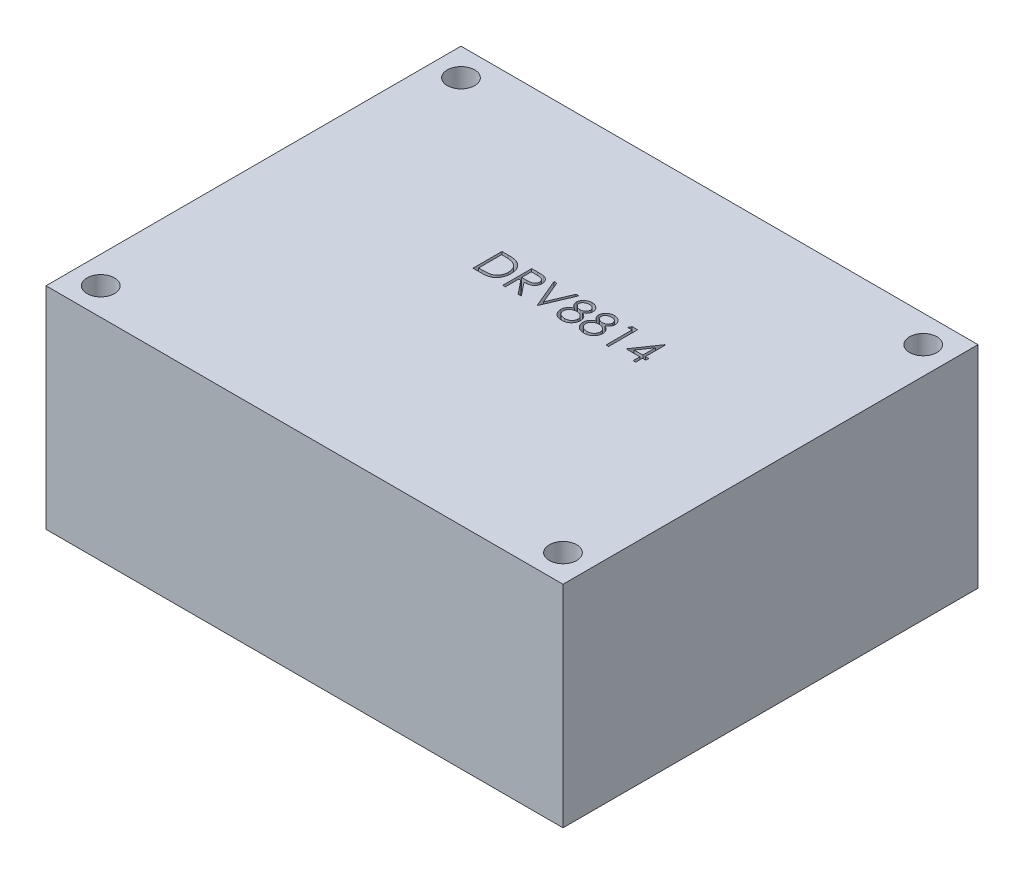
from build123d import *

# Parameters (mm, degrees)
SKETCH1_W           = 56.642
SKETCH1_H           = 45.466
BOSS_EXTRUDE1_DEPTH = 23.114
SKETCH2_R           = 1.5
CUT_EXTRUDE1_DEPTH  = 77.221586942
CUT_EXTRUDE2_DEPTH  = 1.27


with BuildPart() as part:
    # Sketch1 → Boss-Extrude1 (new body)
    with BuildSketch(Plane(origin=(0, 0, 0), x_dir=(1, 0, 0), z_dir=(0, 1, 0))):
        with Locations((28.321, 22.733)):
            Rectangle(SKETCH1_W, SKETCH1_H)
    extrude(amount=BOSS_EXTRUDE1_DEPTH)

    # Sketch2 → Cut-Extrude1 (cut, through all)
    with BuildSketch(Plane(origin=(0, 0, 0), x_dir=(-1, 0, 0), z_dir=(0, -1, 0))):
        with Locations(Location((-3, 42.466, 0), (0, 0, 90))):
            Circle(SKETCH2_R)
        with Locations(Location((-53.642, 42.466, 0), (0, 0, 270))):
            Circle(SKETCH2_R)
        with Locations(Location((-3, 3, 0), (0, 0, 270))):
            Circle(SKETCH2_R)
        with Locations(Location((-53.642, 3, 0), (0, 0, 90))):
            Circle(SKETCH2_R)
    extrude(amount=-CUT_EXTRUDE1_DEPTH, mode=Mode.SUBTRACT)

    # Sketch3 → Cut-Extrude2 (cut)
    # profile 1 of 7: a face of its own
    with BuildSketch(Plane(origin=(0, 23.114, 0), x_dir=(1, 0, 0), z_dir=(0, 1, 0))):
        with BuildLine():
            Line((21.72409313, 25.057589559), (21.72409313, 28.232589559))
            Line((21.72409313, 28.232589559), (22.365198899, 28.232589559))
            add(Edge.make_bspline(
                [(22.365198899, 28.232589559), (22.420960053, 28.232188085), (22.528690311, 28.231412439), (22.684367317, 28.226494463), (22.828406873, 28.21779454), (22.960335252, 28.205122184), (23.080514638, 28.189561932), (23.188608518, 28.170057994), (23.285175819, 28.147027297), (23.344565954, 28.127391781), (23.372650822, 28.118106386)],
                knots=[0, 0, 0, 0, 1.314313732, 2.53924729, 3.670748893, 4.714932338, 5.66265055, 6.526160246, 7.303039223, 8, 8, 8, 8], degree=3))
            add(Edge.make_bspline(
                [(23.372650822, 28.118106386), (23.409385336, 28.104108532), (23.482021346, 28.076430248), (23.585442093, 28.02421846), (23.682801529, 27.965060861), (23.774621753, 27.898879471), (23.85880536, 27.823800383), (23.938641095, 27.743012884), (24.010863023, 27.653579176), (24.077001263, 27.557354008), (24.136632897, 27.455470932), (24.188466276, 27.348124083), (24.231513827, 27.235858616), (24.267249111, 27.118986732), (24.295412683, 26.997251446), (24.314627721, 26.870511011), (24.327301405, 26.739266317), (24.32857508, 26.650208054), (24.329221335, 26.605020449)],
                knots=[0, 0, 0, 0, 0.984719456, 1.947108742, 2.898477687, 3.838006223, 4.779231079, 5.722358779, 6.681677486, 7.655904652, 8.64651281, 9.637519902, 10.640069247, 11.656948941, 12.698408672, 13.768548281, 14.867775369, 16, 16, 16, 16], degree=3))
            add(Edge.make_bspline(
                [(24.329221335, 26.605020449), (24.328650772, 26.565776325), (24.327526417, 26.488441681), (24.317430538, 26.37446744), (24.302756304, 26.263874414), (24.280037639, 26.157189244), (24.252458216, 26.053477217), (24.217112165, 25.953843681), (24.176621393, 25.857374654), (24.129404718, 25.765374516), (24.077569318, 25.678213171), (24.021941737, 25.596048227), (23.962581306, 25.520052133), (23.898921982, 25.449994749), (23.831786411, 25.385981689), (23.760735054, 25.327478218), (23.685584572, 25.275629057), (23.606671559, 25.228396752), (23.521693928, 25.187194001), (23.429042106, 25.152332492), (23.328320966, 25.123443063), (23.219777734, 25.099339464), (23.103224865, 25.08021934), (22.978548089, 25.067404684), (22.845938962, 25.058738809), (22.754880628, 25.057980081), (22.708012401, 25.057589559)],
                knots=[0, 0, 0, 0, 1.105936401, 2.179363191, 3.223086493, 4.248585256, 5.251745608, 6.245858792, 7.225916811, 8.198733463, 9.158002045, 10.082870192, 10.993790845, 11.873723703, 12.748670949, 13.606408763, 14.465103618, 15.319838547, 16.196477973, 17.123216899, 18.106603292, 19.147568657, 20.255746949, 21.433717677, 22.679120308, 24, 24, 24, 24], degree=3))
            Line((22.708012401, 25.057589559), (21.72409313, 25.057589559))
        make_face()
        with BuildLine():
            Line((22.009029027, 25.383230585), (22.373467128, 25.383230585))
            add(Edge.make_bspline(
                [(22.373467128, 25.383230585), (22.425835007, 25.383455644), (22.526557617, 25.383888514), (22.671390229, 25.387686906), (22.803723682, 25.39389352), (22.923576765, 25.402579484), (23.030881809, 25.414071728), (23.125863068, 25.426885032), (23.208209195, 25.442848434), (23.258038041, 25.457318233), (23.281064284, 25.464004824)],
                knots=[0, 0, 0, 0, 1.375205317, 2.645023457, 3.804390687, 4.853969522, 5.800190428, 6.637939096, 7.370582563, 8, 8, 8, 8], degree=3))
            add(Edge.make_bspline(
                [(23.281064284, 25.464004824), (23.310046012, 25.474211594), (23.367317241, 25.494381347), (23.449759368, 25.53117294), (23.52664608, 25.57475396), (23.599317317, 25.623197452), (23.666742212, 25.678212039), (23.729719803, 25.738601436), (23.788123294, 25.804672982), (23.841349273, 25.876344671), (23.888981806, 25.953170415), (23.930230707, 26.034394928), (23.96638174, 26.119128249), (23.994755891, 26.208671557), (24.016995029, 26.302224346), (24.032747281, 26.399793196), (24.042557781, 26.501359888), (24.043702095, 26.570440743), (24.044285438, 26.605656466)],
                knots=[0, 0, 0, 0, 0.998632004, 1.973411704, 2.929992603, 3.868527914, 4.809262121, 5.754881198, 6.702106254, 7.672490631, 8.653608572, 9.636854334, 10.631411391, 11.644891563, 12.686317036, 13.754757253, 14.855430412, 16, 16, 16, 16], degree=3))
            add(Edge.make_bspline(
                [(24.044285438, 26.605656466), (24.043819813, 26.64278898), (24.042905088, 26.715736133), (24.031407678, 26.82277055), (24.014605981, 26.925713711), (23.990309352, 27.024572503), (23.959347769, 27.119539794), (23.920708344, 27.210090349), (23.876560768, 27.297180481), (23.824034169, 27.378800084), (23.766507167, 27.45599169), (23.702664376, 27.526707935), (23.633520098, 27.591109907), (23.559828485, 27.650200569), (23.479512688, 27.701602618), (23.394464697, 27.747582679), (23.303436838, 27.786604237), (23.24010675, 27.807358634), (23.207922256, 27.817906066)],
                knots=[0, 0, 0, 0, 1.122418816, 2.205001699, 3.251619955, 4.274784885, 5.280384055, 6.268708349, 7.249350384, 8.229342522, 9.199999885, 10.157847722, 11.105861043, 12.055065948, 13.010012805, 13.98527497, 14.976112212, 16, 16, 16, 16], degree=3))
            add(Edge.make_bspline(
                [(23.207922256, 27.817906066), (23.181296574, 27.825268825), (23.124683067, 27.840924072), (23.032300124, 27.858001374), (22.92832781, 27.873064027), (22.81230451, 27.885816677), (22.684362479, 27.894967318), (22.544403319, 27.901835582), (22.392366535, 27.906468028), (22.28697238, 27.906784355), (22.232271215, 27.906948533)],
                knots=[0, 0, 0, 0, 0.674548936, 1.434276114, 2.292660221, 3.240891867, 4.284742987, 5.42552168, 6.663806718, 8, 8, 8, 8], degree=3))
            Line((22.232271215, 27.906948533), (22.009029027, 27.906948533))
            Line((22.009029027, 27.906948533), (22.009029027, 25.383230585))
        make_face(mode=Mode.SUBTRACT)
    # profile 2 of 7: a face of its own
    with BuildSketch(Plane(origin=(0, 23.114, 0), x_dir=(1, 0, 0), z_dir=(0, 1, 0))):
        with BuildLine():
            Line((24.980503386, 28.232589559), (25.615884997, 28.232589559))
            add(Edge.make_bspline(
                [(25.615884997, 28.232589559), (25.658285878, 28.23244842), (25.739700266, 28.232177418), (25.85633459, 28.230666334), (25.962313456, 28.226335311), (26.057581453, 28.222608239), (26.142136833, 28.215811978), (26.216238876, 28.209316248), (26.279546287, 28.200812998), (26.317869309, 28.192915936), (26.335220934, 28.18934036)],
                knots=[0, 0, 0, 0, 1.410062039, 2.707475311, 3.878576406, 4.937260626, 5.877586885, 6.699081471, 7.410979367, 8, 8, 8, 8], degree=3))
            add(Edge.make_bspline(
                [(26.335220934, 28.18934036), (26.358449801, 28.18360108), (26.404411998, 28.172244955), (26.470588129, 28.148242317), (26.533647552, 28.120465943), (26.593328321, 28.087841711), (26.649331503, 28.050127447), (26.702234542, 28.007974221), (26.752277498, 27.961612685), (26.797436549, 27.909873936), (26.840016974, 27.855593673), (26.875929514, 27.796898122), (26.906887106, 27.735519451), (26.931534646, 27.670833436), (26.951381094, 27.6034674), (26.965374897, 27.532811135), (26.973767045, 27.459186536), (26.974621443, 27.408969004), (26.975054668, 27.383506025)],
                knots=[0, 0, 0, 0, 1.027469482, 2.033020251, 3.019912614, 3.986113645, 4.951240523, 5.91722682, 6.890402269, 7.87763091, 8.8651537, 9.85103654, 10.82876324, 11.815024772, 12.821070561, 13.842952187, 14.906261191, 16, 16, 16, 16], degree=3))
            add(Edge.make_bspline(
                [(26.975054668, 27.383506025), (26.973722077, 27.341201323), (26.971121847, 27.258653893), (26.94687836, 27.138855807), (26.907166803, 27.0271055), (26.852444962, 26.923543679), (26.782758723, 26.830189022), (26.699006948, 26.748191966), (26.601142915, 26.67957576), (26.510039179, 26.631993573), (26.429562726, 26.601520005), (26.363311078, 26.580078451), (26.291041748, 26.56351224), (26.213447166, 26.548671263), (26.130204422, 26.537466512), (26.041513029, 26.529259958), (25.947309734, 26.524130929), (25.882595007, 26.52336711), (25.849303466, 26.522974175)],
                knots=[0, 0, 0, 0, 1.260483769, 2.459530307, 3.627416485, 4.787058657, 5.939039949, 7.08810263, 8.267026773, 9.491475466, 10.141966685, 10.831826277, 11.566392101, 12.351337768, 13.187381173, 14.07005841, 15.007169909, 16, 16, 16, 16], degree=3))
            Line((25.849303466, 26.522974175), (27.015759797, 25.057589559))
            Line((27.015759797, 25.057589559), (26.663406031, 25.057589559))
            Line((26.663406031, 25.057589559), (25.4969497, 26.522974175))
            Line((25.4969497, 26.522974175), (25.265439284, 26.522974175))
            Line((25.265439284, 26.522974175), (25.265439284, 25.057589559))
            Line((25.265439284, 25.057589559), (24.980503386, 25.057589559))
            Line((24.980503386, 25.057589559), (24.980503386, 28.232589559))
        make_face()
        with BuildLine():
            Line((25.265439284, 27.906948533), (25.265439284, 26.8486152))
            Line((25.265439284, 26.8486152), (25.846759396, 26.844163077))
            add(Edge.make_bspline(
                [(25.846759396, 26.844163077), (25.873901146, 26.844151069), (25.926509587, 26.844127795), (26.002619475, 26.847750721), (26.073485577, 26.851872159), (26.13883683, 26.858176209), (26.198702431, 26.866300645), (26.253052456, 26.876463352), (26.301975624, 26.888303438), (26.359033584, 26.906629198), (26.422748152, 26.935663229), (26.49199169, 26.977904789), (26.550958097, 27.031035347), (26.600776443, 27.091789839), (26.640808142, 27.158588436), (26.66903122, 27.230630428), (26.686940435, 27.306097092), (26.689052759, 27.357965804), (26.690118771, 27.384142043)],
                knots=[0, 0, 0, 0, 1.146690395, 2.22261258, 3.21895312, 4.145990853, 4.996080663, 5.770904154, 6.481378293, 7.121626537, 8.300444488, 9.431385265, 10.535395872, 11.636531494, 12.74115979, 13.810798291, 14.895190096, 16, 16, 16, 16], degree=3))
            add(Edge.make_bspline(
                [(26.690118771, 27.384142043), (26.689028275, 27.409675006), (26.686867311, 27.460272023), (26.6692245, 27.534345599), (26.639389132, 27.604256332), (26.599182531, 27.669719829), (26.550197583, 27.729142889), (26.492759281, 27.779985664), (26.42843814, 27.821940536), (26.368320696, 27.848750581), (26.314586803, 27.865187876), (26.267932754, 27.876755003), (26.215217342, 27.8860482), (26.156184605, 27.893494084), (26.091086554, 27.899893926), (26.019594035, 27.904204468), (25.942181384, 27.906757045), (25.888526668, 27.906883219), (25.860751784, 27.906948533)],
                knots=[0, 0, 0, 0, 1.101028733, 2.181837193, 3.264309656, 4.369019818, 5.486613113, 6.575447106, 7.666700264, 8.788928104, 9.402425223, 10.0903467, 10.862060571, 11.710948788, 12.657782767, 13.684531032, 14.801375019, 16, 16, 16, 16], degree=3))
            Line((25.860751784, 27.906948533), (25.265439284, 27.906948533))
        make_face(mode=Mode.SUBTRACT)
    # profile 3 of 7: a face of its own
    with BuildSketch(Plane(origin=(0, 23.114, 0), x_dir=(1, 0, 0), z_dir=(0, 1, 0))):
        Polygon((27.422811079, 28.232589559), (27.72809954, 28.232589559), (28.786432873, 25.73049621), (29.844766207, 28.232589559), (30.150054668, 28.232589559), (28.806785438, 25.057589559), (28.766080309, 25.057589559), align=None)
    # profile 4 of 7: a face of its own
    with BuildSketch(Plane(origin=(0, 23.114, 0), x_dir=(1, 0, 0), z_dir=(0, 1, 0))):
        with BuildLine():
            add(Edge.make_bspline(
                [(31.978605349, 26.826354583), (32.004593674, 26.812803723), (32.055279587, 26.78637502), (32.127467483, 26.743820198), (32.193439449, 26.69897018), (32.255025887, 26.653943365), (32.311144784, 26.607015367), (32.361168644, 26.557999575), (32.406333128, 26.508119467), (32.445727425, 26.456530398), (32.480377412, 26.403369424), (32.510324135, 26.348497012), (32.535921169, 26.292033416), (32.556207549, 26.233362292), (32.572918746, 26.173345483), (32.58441733, 26.111208028), (32.590601249, 26.047359376), (32.591770386, 26.004208131), (32.592362361, 25.982359191)],
                knots=[0, 0, 0, 0, 1.272397273, 2.481599622, 3.635517121, 4.734568067, 5.792894095, 6.808321871, 7.773003508, 8.711915296, 9.623354172, 10.525449501, 11.423591555, 12.311487226, 13.218079475, 14.126165749, 15.051214107, 16, 16, 16, 16], degree=3))
            add(Edge.make_bspline(
                [(32.592362361, 25.982359191), (32.591662572, 25.951790533), (32.590277428, 25.89128369), (32.578212442, 25.801979003), (32.560148526, 25.715245458), (32.533769254, 25.63110207), (32.499557821, 25.550013139), (32.457396691, 25.471909251), (32.409670812, 25.395510307), (32.371341995, 25.348502706), (32.351947697, 25.324716963)],
                knots=[0, 0, 0, 0, 1.025265484, 2.029385089, 3.018602448, 3.995076438, 4.983346944, 5.966715145, 6.97116228, 8, 8, 8, 8], degree=3))
            add(Edge.make_bspline(
                [(32.351947697, 25.324716963), (32.326696038, 25.296964039), (32.276504762, 25.241801142), (32.190523107, 25.170181479), (32.096160398, 25.1099931), (31.993781767, 25.060942167), (31.883660883, 25.022764281), (31.765821207, 24.995329997), (31.640033011, 24.979616079), (31.553577334, 24.977344602), (31.50922434, 24.976179303)],
                knots=[0, 0, 0, 0, 0.954267603, 1.896743057, 2.838368354, 3.796610408, 4.779680527, 5.799409237, 6.871065594, 8, 8, 8, 8], degree=3))
            add(Edge.make_bspline(
                [(31.50922434, 24.976179303), (31.46657648, 24.977224765), (31.383588077, 24.979259128), (31.26279486, 24.993042648), (31.150197503, 25.017197927), (31.045141318, 25.050258394), (30.948259646, 25.093266244), (30.859828547, 25.146795301), (30.778572158, 25.208690966), (30.706956428, 25.28073088), (30.643376197, 25.357890521), (30.587525178, 25.437493767), (30.541102978, 25.519547884), (30.501799113, 25.602829375), (30.471710978, 25.688505529), (30.450871901, 25.776135541), (30.437637309, 25.865566349), (30.435876423, 25.925920063), (30.434990566, 25.956282468)],
                knots=[0, 0, 0, 0, 1.256902934, 2.445805442, 3.576955095, 4.645999104, 5.686449165, 6.692658513, 7.68621702, 8.689161843, 9.678783111, 10.630372946, 11.551080876, 12.453998257, 13.34127905, 14.221779781, 15.105423033, 16, 16, 16, 16], degree=3))
            add(Edge.make_bspline(
                [(30.434990566, 25.956282468), (30.435514786, 25.978561163), (30.436550831, 26.022591729), (30.443721658, 26.087642334), (30.455250048, 26.1509574), (30.470906841, 26.212770788), (30.492125844, 26.272632486), (30.517745493, 26.33082613), (30.547619478, 26.387417419), (30.582164535, 26.442715833), (30.6223528, 26.495946533), (30.667858396, 26.5480129), (30.71959082, 26.598107022), (30.776974554, 26.646840936), (30.839353814, 26.695079141), (30.90834886, 26.740214695), (30.98213066, 26.785442991), (31.034568421, 26.812483401), (31.06146793, 26.826354583)],
                knots=[0, 0, 0, 0, 0.941657376, 1.861047343, 2.762797495, 3.66048619, 4.553285746, 5.444104102, 6.34607688, 7.256116206, 8.197091036, 9.162375105, 10.176350973, 11.237807142, 12.343728897, 13.50695164, 14.721116704, 16, 16, 16, 16], degree=3))
            add(Edge.make_bspline(
                [(31.06146793, 26.826354583), (31.024645754, 26.84643398), (30.953347716, 26.885313314), (30.858941865, 26.956747916), (30.7778518, 27.034116148), (30.712306449, 27.119051748), (30.660715213, 27.208901413), (30.625319765, 27.303102984), (30.601374383, 27.399909744), (30.599002361, 27.46604608), (30.597811079, 27.499261234)],
                knots=[0, 0, 0, 0, 1.166880483, 2.259407225, 3.286803203, 4.280235371, 5.237608625, 6.161067461, 7.076446754, 8, 8, 8, 8], degree=3))
            add(Edge.make_bspline(
                [(30.597811079, 27.499261234), (30.599294642, 27.533095447), (30.602276863, 27.601108118), (30.626391732, 27.702350815), (30.665689221, 27.801788699), (30.719138983, 27.89893981), (30.785711672, 27.990516076), (30.865582467, 28.072649649), (30.956844029, 28.144596494), (31.059040808, 28.204990593), (31.169019394, 28.254142912), (31.285057229, 28.288050482), (31.405132548, 28.31021753), (31.48686405, 28.312727281), (31.528304869, 28.313999816)],
                knots=[0, 0, 0, 0, 0.888701115, 1.786444228, 2.72001202, 3.692817113, 4.693886446, 5.687152267, 6.695133018, 7.739871481, 8.800368666, 9.853104506, 10.91144658, 12, 12, 12, 12], degree=3))
            add(Edge.make_bspline(
                [(31.528304869, 28.313999816), (31.568676187, 28.312687776), (31.648283826, 28.310100583), (31.765300381, 28.288522486), (31.877264377, 28.252482136), (31.983789708, 28.203589655), (32.082969331, 28.143367216), (32.170601426, 28.070432137), (32.248010268, 27.988660873), (32.312040397, 27.897112376), (32.364802447, 27.800334572), (32.40154255, 27.699076999), (32.425084698, 27.595527496), (32.428054107, 27.525461592), (32.429541848, 27.490356987)],
                knots=[0, 0, 0, 0, 1.072916533, 2.115669174, 3.151510826, 4.193348718, 5.225979165, 6.227137561, 7.216255879, 8.211077061, 9.189680878, 10.138522389, 11.067357538, 12, 12, 12, 12], degree=3))
            add(Edge.make_bspline(
                [(32.429541848, 27.490356987), (32.428240496, 27.455906728), (32.425684716, 27.388248376), (32.404185485, 27.28961789), (32.367978408, 27.197250755), (32.318544417, 27.110098862), (32.254114154, 27.029742789), (32.17554766, 26.955160706), (32.083471319, 26.88573994), (32.014291801, 26.846563738), (31.978605349, 26.826354583)],
                knots=[0, 0, 0, 0, 0.975232327, 1.915300861, 2.843280834, 3.77672583, 4.742871857, 5.749627742, 6.839139064, 8, 8, 8, 8], degree=3))
        make_face()
        with BuildLine():
            add(Edge.make_bspline(
                [(31.512404428, 27.98835879), (31.49013334, 27.98776784), (31.446561353, 27.986611684), (31.382672487, 27.980571349), (31.321918983, 27.968820931), (31.263666078, 27.953182957), (31.208712441, 27.932057425), (31.156311738, 27.907206238), (31.107355787, 27.876992879), (31.061253605, 27.843100935), (31.019751117, 27.805823799), (30.982916988, 27.76698564), (30.95232077, 27.725823677), (30.926339192, 27.683361808), (30.907487387, 27.638339785), (30.89336834, 27.592137932), (30.883823935, 27.544172405), (30.883108752, 27.511391428), (30.882746976, 27.49480911)],
                knots=[0, 0, 0, 0, 1.203892937, 2.355340988, 3.463153438, 4.544400666, 5.610487187, 6.640501085, 7.674077295, 8.714426146, 9.728707835, 10.68524104, 11.601827946, 12.495867327, 13.368432065, 14.231010473, 15.105153427, 16, 16, 16, 16], degree=3))
            add(Edge.make_bspline(
                [(30.882746976, 27.49480911), (30.883370516, 27.478226077), (30.884602721, 27.44545562), (30.894132372, 27.397063299), (30.908335376, 27.349509385), (30.930697048, 27.30392463), (30.957517959, 27.258727726), (30.990620941, 27.215048266), (31.030071702, 27.172734238), (31.074546594, 27.132145545), (31.122998489, 27.094137381), (31.174328299, 27.06114171), (31.227891812, 27.033533624), (31.283138689, 27.010556235), (31.340631995, 26.992694649), (31.400019438, 26.980023091), (31.461311001, 26.97214728), (31.502840528, 26.971206553), (31.523852745, 26.970730585)],
                knots=[0, 0, 0, 0, 0.873023192, 1.725219244, 2.590779336, 3.480155217, 4.391973325, 5.357036234, 6.360879153, 7.436073238, 8.526419356, 9.601555421, 10.645666583, 11.697338044, 12.750135903, 13.812665442, 14.89329948, 16, 16, 16, 16], degree=3))
            add(Edge.make_bspline(
                [(31.523852745, 26.970730585), (31.550840339, 26.9715224), (31.604548973, 26.97309821), (31.683723795, 26.987749632), (31.760706337, 27.010796428), (31.834673772, 27.042328683), (31.903711502, 27.081905385), (31.965252136, 27.129288194), (32.018770746, 27.183383025), (32.063711156, 27.24334774), (32.098554374, 27.307166681), (32.125679586, 27.371211233), (32.141519402, 27.436164685), (32.143585481, 27.479677574), (32.14460595, 27.501169287)],
                knots=[0, 0, 0, 0, 1.076279235, 2.141928126, 3.20205304, 4.278698113, 5.344010996, 6.36967002, 7.368914609, 8.37248503, 9.349703398, 10.264243087, 11.142681841, 12, 12, 12, 12], degree=3))
            add(Edge.make_bspline(
                [(32.14460595, 27.501169287), (32.144123443, 27.516253291), (32.143165736, 27.546192877), (32.135273542, 27.590405537), (32.122232608, 27.633612373), (32.104576814, 27.676170319), (32.081345072, 27.717482268), (32.053800416, 27.758197641), (32.020340904, 27.797400513), (31.982788425, 27.836004474), (31.940202233, 27.87173141), (31.892664398, 27.90315004), (31.840418639, 27.929831249), (31.78346372, 27.951501763), (31.722009396, 27.967778037), (31.656338717, 27.979966724), (31.585904112, 27.986836618), (31.537435694, 27.987840395), (31.512404428, 27.98835879)],
                knots=[0, 0, 0, 0, 0.814439003, 1.616544685, 2.417341072, 3.248991801, 4.09997495, 4.973547432, 5.9003056, 6.880240646, 7.880314356, 8.896779544, 9.951930927, 11.043077905, 12.18215768, 13.381699519, 14.647792085, 16, 16, 16, 16], degree=3))
        make_face(mode=Mode.SUBTRACT)
        with BuildLine():
            add(Edge.make_bspline(
                [(31.530848939, 26.645089559), (31.502613405, 26.644587327), (31.447222177, 26.643602071), (31.366071964, 26.632635167), (31.288190878, 26.617368503), (31.213841507, 26.594208386), (31.143055248, 26.564094427), (31.0754489, 26.527868094), (31.011539661, 26.485046013), (30.952210045, 26.436172226), (30.898032453, 26.383504007), (30.850499709, 26.327749071), (30.810134102, 26.26994363), (30.777628224, 26.209353536), (30.750947581, 26.147261775), (30.733427136, 26.082122028), (30.722195154, 26.015186575), (30.72068691, 25.9696842), (30.719926463, 25.946742203)],
                knots=[0, 0, 0, 0, 1.140299081, 2.23698856, 3.303958914, 4.344563908, 5.37730929, 6.408454204, 7.439741482, 8.480804886, 9.510774543, 10.48932336, 11.43758569, 12.353841022, 13.263987381, 14.161954604, 15.073269652, 16, 16, 16, 16], degree=3))
            add(Edge.make_bspline(
                [(30.719926463, 25.946742203), (30.721163134, 25.918229881), (30.723616659, 25.861662101), (30.743080896, 25.778057029), (30.774318846, 25.697120786), (30.817884577, 25.619512944), (30.871830161, 25.546986776), (30.938166314, 25.483769101), (31.012770503, 25.427597474), (31.098166984, 25.382167275), (31.191447093, 25.345886228), (31.292586018, 25.320889034), (31.400132266, 25.304341433), (31.474390611, 25.30267394), (31.512404428, 25.301820328)],
                knots=[0, 0, 0, 0, 0.898778495, 1.783155532, 2.693654817, 3.627872908, 4.583023416, 5.533784346, 6.509005473, 7.520592997, 8.575161974, 9.658835044, 10.801527049, 12, 12, 12, 12], degree=3))
            add(Edge.make_bspline(
                [(31.512404428, 25.301820328), (31.54211369, 25.302390747), (31.59999686, 25.303502107), (31.684439114, 25.313312217), (31.764126669, 25.328869376), (31.838904993, 25.351496735), (31.909611191, 25.379119214), (31.975046447, 25.414653888), (32.036894111, 25.45506921), (32.092106566, 25.503019109), (32.142392405, 25.554254079), (32.186237606, 25.60849219), (32.224299099, 25.66425937), (32.25417218, 25.722815882), (32.278053853, 25.783038297), (32.295220221, 25.845481939), (32.305812216, 25.910338329), (32.306883457, 25.954333915), (32.307426463, 25.976635032)],
                knots=[0, 0, 0, 0, 1.224942928, 2.386581632, 3.501229538, 4.569074225, 5.605009692, 6.626002462, 7.634866581, 8.645888296, 9.63523824, 10.59253846, 11.518950513, 12.414518923, 13.29783783, 14.186679152, 15.080837789, 16, 16, 16, 16], degree=3))
            add(Edge.make_bspline(
                [(32.307426463, 25.976635032), (32.306604729, 25.998295191), (32.304984413, 26.041005241), (32.294700415, 26.104293447), (32.276633869, 26.165437428), (32.251844016, 26.225172791), (32.218841286, 26.282289182), (32.179974868, 26.338274566), (32.133080917, 26.391575055), (32.080092348, 26.442604649), (32.022344577, 26.489790353), (31.960960809, 26.531532023), (31.896413547, 26.566685728), (31.828839378, 26.595275692), (31.758388345, 26.617761468), (31.685112267, 26.633469549), (31.608925353, 26.643357046), (31.557168434, 26.64450553), (31.530848939, 26.645089559)],
                knots=[0, 0, 0, 0, 0.917430815, 1.809013306, 2.70690318, 3.612392954, 4.541220862, 5.495268465, 6.494511384, 7.542276156, 8.608045339, 9.649016899, 10.681629292, 11.715607085, 12.752076957, 13.808767841, 14.885711793, 16, 16, 16, 16], degree=3))
        make_face(mode=Mode.SUBTRACT)
    # profile 5 of 7: a face of its own
    with BuildSketch(Plane(origin=(0, 23.114, 0), x_dir=(1, 0, 0), z_dir=(0, 1, 0))):
        with BuildLine():
            add(Edge.make_bspline(
                [(34.420913042, 26.826354583), (34.446901367, 26.812803723), (34.497587279, 26.78637502), (34.569775176, 26.743820198), (34.635747141, 26.69897018), (34.697333579, 26.653943365), (34.753452476, 26.607015367), (34.803476336, 26.557999575), (34.84864082, 26.508119467), (34.888035117, 26.456530398), (34.922685104, 26.403369424), (34.952631827, 26.348497012), (34.978228861, 26.292033416), (34.998515241, 26.233362292), (35.015226438, 26.173345483), (35.026725023, 26.111208028), (35.032908941, 26.047359376), (35.034078079, 26.004208131), (35.034670053, 25.982359191)],
                knots=[0, 0, 0, 0, 1.272397273, 2.481599622, 3.635517121, 4.734568067, 5.792894095, 6.808321871, 7.773003508, 8.711915296, 9.623354172, 10.525449501, 11.423591555, 12.311487226, 13.218079475, 14.126165749, 15.051214107, 16, 16, 16, 16], degree=3))
            add(Edge.make_bspline(
                [(35.034670053, 25.982359191), (35.033970264, 25.951790533), (35.03258512, 25.89128369), (35.020520135, 25.801979003), (35.002456218, 25.715245458), (34.976076947, 25.63110207), (34.941865513, 25.550013139), (34.899704384, 25.471909251), (34.851978505, 25.395510307), (34.813649688, 25.348502706), (34.79425539, 25.324716963)],
                knots=[0, 0, 0, 0, 1.025265484, 2.029385089, 3.018602448, 3.995076438, 4.983346944, 5.966715145, 6.97116228, 8, 8, 8, 8], degree=3))
            add(Edge.make_bspline(
                [(34.79425539, 25.324716963), (34.769003731, 25.296964039), (34.718812455, 25.241801142), (34.632830799, 25.170181479), (34.53846809, 25.1099931), (34.43608946, 25.060942167), (34.325968575, 25.022764281), (34.208128899, 24.995329997), (34.082340703, 24.979616079), (33.995885026, 24.977344602), (33.951532032, 24.976179303)],
                knots=[0, 0, 0, 0, 0.954267603, 1.896743057, 2.838368354, 3.796610408, 4.779680527, 5.799409237, 6.871065594, 8, 8, 8, 8], degree=3))
            add(Edge.make_bspline(
                [(33.951532032, 24.976179303), (33.908884172, 24.977224765), (33.825895769, 24.979259128), (33.705102552, 24.993042648), (33.592505196, 25.017197927), (33.48744901, 25.050258394), (33.390567338, 25.093266244), (33.302136239, 25.146795301), (33.22087985, 25.208690966), (33.149264121, 25.28073088), (33.085683889, 25.357890521), (33.02983287, 25.437493767), (32.98341067, 25.519547884), (32.944106805, 25.602829375), (32.91401867, 25.688505529), (32.893179594, 25.776135541), (32.879945002, 25.865566349), (32.878184115, 25.925920063), (32.877298258, 25.956282468)],
                knots=[0, 0, 0, 0, 1.256902934, 2.445805442, 3.576955095, 4.645999104, 5.686449165, 6.692658513, 7.68621702, 8.689161843, 9.678783111, 10.630372946, 11.551080876, 12.453998257, 13.34127905, 14.221779781, 15.105423033, 16, 16, 16, 16], degree=3))
            add(Edge.make_bspline(
                [(32.877298258, 25.956282468), (32.877822479, 25.978561163), (32.878858524, 26.022591729), (32.88602935, 26.087642334), (32.89755774, 26.1509574), (32.913214533, 26.212770788), (32.934433536, 26.272632486), (32.960053185, 26.33082613), (32.989927171, 26.387417419), (33.024472227, 26.442715833), (33.064660492, 26.495946533), (33.110166089, 26.5480129), (33.161898512, 26.598107022), (33.219282246, 26.646840936), (33.281661507, 26.695079141), (33.350656552, 26.740214695), (33.424438352, 26.785442991), (33.476876113, 26.812483401), (33.503775622, 26.826354583)],
                knots=[0, 0, 0, 0, 0.941657376, 1.861047343, 2.762797495, 3.66048619, 4.553285746, 5.444104102, 6.34607688, 7.256116206, 8.197091036, 9.162375105, 10.176350973, 11.237807142, 12.343728897, 13.50695164, 14.721116704, 16, 16, 16, 16], degree=3))
            add(Edge.make_bspline(
                [(33.503775622, 26.826354583), (33.466953446, 26.84643398), (33.395655408, 26.885313314), (33.301249558, 26.956747916), (33.220159492, 27.034116148), (33.154614141, 27.119051748), (33.103022906, 27.208901413), (33.067627457, 27.303102984), (33.043682075, 27.399909744), (33.041310054, 27.46604608), (33.040118771, 27.499261234)],
                knots=[0, 0, 0, 0, 1.166880483, 2.259407225, 3.286803203, 4.280235371, 5.237608625, 6.161067461, 7.076446754, 8, 8, 8, 8], degree=3))
            add(Edge.make_bspline(
                [(33.040118771, 27.499261234), (33.041602334, 27.533095447), (33.044584555, 27.601108118), (33.068699425, 27.702350815), (33.107996913, 27.801788699), (33.161446675, 27.89893981), (33.228019364, 27.990516076), (33.307890159, 28.072649649), (33.399151721, 28.144596494), (33.501348501, 28.204990593), (33.611327086, 28.254142912), (33.727364921, 28.288050482), (33.84744024, 28.31021753), (33.929171742, 28.312727281), (33.970612561, 28.313999816)],
                knots=[0, 0, 0, 0, 0.888701115, 1.786444228, 2.72001202, 3.692817113, 4.693886446, 5.687152267, 6.695133018, 7.739871481, 8.800368666, 9.853104506, 10.91144658, 12, 12, 12, 12], degree=3))
            add(Edge.make_bspline(
                [(33.970612561, 28.313999816), (34.010983879, 28.312687776), (34.090591519, 28.310100583), (34.207608074, 28.288522486), (34.319572069, 28.252482136), (34.426097401, 28.203589655), (34.525277023, 28.143367216), (34.612909118, 28.070432137), (34.69031796, 27.988660873), (34.754348089, 27.897112376), (34.807110139, 27.800334572), (34.843850242, 27.699076999), (34.86739239, 27.595527496), (34.870361799, 27.525461592), (34.87184954, 27.490356987)],
                knots=[0, 0, 0, 0, 1.072916533, 2.115669174, 3.151510826, 4.193348718, 5.225979165, 6.227137561, 7.216255879, 8.211077061, 9.189680878, 10.138522389, 11.067357538, 12, 12, 12, 12], degree=3))
            add(Edge.make_bspline(
                [(34.87184954, 27.490356987), (34.870548189, 27.455906728), (34.867992408, 27.388248376), (34.846493178, 27.28961789), (34.8102861, 27.197250755), (34.76085211, 27.110098862), (34.696421846, 27.029742789), (34.617855352, 26.955160706), (34.525779011, 26.88573994), (34.456599493, 26.846563738), (34.420913042, 26.826354583)],
                knots=[0, 0, 0, 0, 0.975232327, 1.915300861, 2.843280834, 3.77672583, 4.742871857, 5.749627742, 6.839139064, 8, 8, 8, 8], degree=3))
        make_face()
        with BuildLine():
            add(Edge.make_bspline(
                [(33.95471212, 27.98835879), (33.932441032, 27.98776784), (33.888869046, 27.986611684), (33.82498018, 27.980571349), (33.764226675, 27.968820931), (33.70597377, 27.953182957), (33.651020133, 27.932057425), (33.59861943, 27.907206238), (33.549663479, 27.876992879), (33.503561297, 27.843100935), (33.462058809, 27.805823799), (33.42522468, 27.76698564), (33.394628462, 27.725823677), (33.368646884, 27.683361808), (33.349795079, 27.638339785), (33.335676032, 27.592137932), (33.326131627, 27.544172405), (33.325416445, 27.511391428), (33.325054668, 27.49480911)],
                knots=[0, 0, 0, 0, 1.203892937, 2.355340988, 3.463153438, 4.544400666, 5.610487187, 6.640501085, 7.674077295, 8.714426146, 9.728707835, 10.68524104, 11.601827946, 12.495867327, 13.368432065, 14.231010473, 15.105153427, 16, 16, 16, 16], degree=3))
            add(Edge.make_bspline(
                [(33.325054668, 27.49480911), (33.325678208, 27.478226077), (33.326910413, 27.44545562), (33.336440065, 27.397063299), (33.350643069, 27.349509385), (33.37300474, 27.30392463), (33.399825651, 27.258727726), (33.432928633, 27.215048266), (33.472379394, 27.172734238), (33.516854286, 27.132145545), (33.565306181, 27.094137381), (33.616635992, 27.06114171), (33.670199504, 27.033533624), (33.725446381, 27.010556235), (33.782939687, 26.992694649), (33.842327131, 26.980023091), (33.903618693, 26.97214728), (33.94514822, 26.971206553), (33.966160438, 26.970730585)],
                knots=[0, 0, 0, 0, 0.873023192, 1.725219244, 2.590779336, 3.480155217, 4.391973325, 5.357036234, 6.360879153, 7.436073238, 8.526419356, 9.601555421, 10.645666583, 11.697338044, 12.750135903, 13.812665442, 14.89329948, 16, 16, 16, 16], degree=3))
            add(Edge.make_bspline(
                [(33.966160438, 26.970730585), (33.993148032, 26.9715224), (34.046856665, 26.97309821), (34.126031487, 26.987749632), (34.203014029, 27.010796428), (34.276981464, 27.042328683), (34.346019195, 27.081905385), (34.407559828, 27.129288194), (34.461078438, 27.183383025), (34.506018849, 27.24334774), (34.540862067, 27.307166681), (34.567987278, 27.371211233), (34.583827095, 27.436164685), (34.585893173, 27.479677574), (34.586913643, 27.501169287)],
                knots=[0, 0, 0, 0, 1.076279235, 2.141928126, 3.20205304, 4.278698113, 5.344010996, 6.36967002, 7.368914609, 8.37248503, 9.349703398, 10.264243087, 11.142681841, 12, 12, 12, 12], degree=3))
            add(Edge.make_bspline(
                [(34.586913643, 27.501169287), (34.586431136, 27.516253291), (34.585473428, 27.546192877), (34.577581235, 27.590405537), (34.5645403, 27.633612373), (34.546884506, 27.676170319), (34.523652764, 27.717482268), (34.496108108, 27.758197641), (34.462648596, 27.797400513), (34.425096117, 27.836004474), (34.382509925, 27.87173141), (34.33497209, 27.90315004), (34.282726331, 27.929831249), (34.225771412, 27.951501763), (34.164317088, 27.967778037), (34.098646409, 27.979966724), (34.028211804, 27.986836618), (33.979743387, 27.987840395), (33.95471212, 27.98835879)],
                knots=[0, 0, 0, 0, 0.814439003, 1.616544685, 2.417341072, 3.248991801, 4.09997495, 4.973547432, 5.9003056, 6.880240646, 7.880314356, 8.896779544, 9.951930927, 11.043077905, 12.18215768, 13.381699519, 14.647792085, 16, 16, 16, 16], degree=3))
        make_face(mode=Mode.SUBTRACT)
        with BuildLine():
            add(Edge.make_bspline(
                [(33.973156631, 26.645089559), (33.944921097, 26.644587327), (33.889529869, 26.643602071), (33.808379656, 26.632635167), (33.73049857, 26.617368503), (33.656149199, 26.594208386), (33.58536294, 26.564094427), (33.517756592, 26.527868094), (33.453847353, 26.485046013), (33.394517737, 26.436172226), (33.340340145, 26.383504007), (33.292807402, 26.327749071), (33.252441794, 26.26994363), (33.219935916, 26.209353536), (33.193255274, 26.147261775), (33.175734828, 26.082122028), (33.164502847, 26.015186575), (33.162994602, 25.9696842), (33.162234156, 25.946742203)],
                knots=[0, 0, 0, 0, 1.140299081, 2.23698856, 3.303958914, 4.344563908, 5.37730929, 6.408454204, 7.439741482, 8.480804886, 9.510774543, 10.48932336, 11.43758569, 12.353841022, 13.263987381, 14.161954604, 15.073269652, 16, 16, 16, 16], degree=3))
            add(Edge.make_bspline(
                [(33.162234156, 25.946742203), (33.163470826, 25.918229881), (33.165924351, 25.861662101), (33.185388588, 25.778057029), (33.216626538, 25.697120786), (33.26019227, 25.619512944), (33.314137853, 25.546986776), (33.380474006, 25.483769101), (33.455078195, 25.427597474), (33.540474677, 25.382167275), (33.633754785, 25.345886228), (33.734893711, 25.320889034), (33.842439958, 25.304341433), (33.916698303, 25.30267394), (33.95471212, 25.301820328)],
                knots=[0, 0, 0, 0, 0.898778495, 1.783155532, 2.693654817, 3.627872908, 4.583023416, 5.533784346, 6.509005473, 7.520592997, 8.575161974, 9.658835044, 10.801527049, 12, 12, 12, 12], degree=3))
            add(Edge.make_bspline(
                [(33.95471212, 25.301820328), (33.984421383, 25.302390747), (34.042304553, 25.303502107), (34.126746806, 25.313312217), (34.206434361, 25.328869376), (34.281212685, 25.351496735), (34.351918883, 25.379119214), (34.41735414, 25.414653888), (34.479201804, 25.45506921), (34.534414258, 25.503019109), (34.584700097, 25.554254079), (34.628545298, 25.60849219), (34.666606791, 25.66425937), (34.696479872, 25.722815882), (34.720361546, 25.783038297), (34.737527913, 25.845481939), (34.748119908, 25.910338329), (34.749191149, 25.954333915), (34.749734156, 25.976635032)],
                knots=[0, 0, 0, 0, 1.224942928, 2.386581632, 3.501229538, 4.569074225, 5.605009692, 6.626002462, 7.634866581, 8.645888296, 9.63523824, 10.59253846, 11.518950513, 12.414518923, 13.29783783, 14.186679152, 15.080837789, 16, 16, 16, 16], degree=3))
            add(Edge.make_bspline(
                [(34.749734156, 25.976635032), (34.748912422, 25.998295191), (34.747292106, 26.041005241), (34.737008107, 26.104293447), (34.718941561, 26.165437428), (34.694151708, 26.225172791), (34.661148978, 26.282289182), (34.62228256, 26.338274566), (34.57538861, 26.391575055), (34.52240004, 26.442604649), (34.464652269, 26.489790353), (34.403268502, 26.531532023), (34.33872124, 26.566685728), (34.27114707, 26.595275692), (34.200696037, 26.617761468), (34.127419959, 26.633469549), (34.051233045, 26.643357046), (33.999476127, 26.64450553), (33.973156631, 26.645089559)],
                knots=[0, 0, 0, 0, 0.917430815, 1.809013306, 2.70690318, 3.612392954, 4.541220862, 5.495268465, 6.494511384, 7.542276156, 8.608045339, 9.649016899, 10.681629292, 11.715607085, 12.752076957, 13.808767841, 14.885711793, 16, 16, 16, 16], degree=3))
        make_face(mode=Mode.SUBTRACT)
    # profile 6 of 7: a face of its own
    with BuildSketch(Plane(origin=(0, 23.114, 0), x_dir=(1, 0, 0), z_dir=(0, 1, 0))):
        Polygon((35.994420654, 28.232589559), (36.581464925, 28.232589559), (36.581464925, 25.057589559), (36.296529027, 25.057589559), (36.296529027, 27.906948533), (35.808067489, 27.906948533), align=None)
    # profile 7 of 7: a face of its own
    with BuildSketch(Plane(origin=(0, 23.114, 0), x_dir=(1, 0, 0), z_dir=(0, 1, 0))):
        Polygon((39.49506168, 28.313999816), (39.552939284, 28.313999816), (39.552939284, 26.115922892), (39.919285438, 26.115922892), (39.919285438, 25.790281867), (39.552939284, 25.790281867), (39.552939284, 25.057589559), (39.268003386, 25.057589559), (39.268003386, 25.790281867), (37.761913643, 25.790281867), align=None)
        Polygon((39.268003386, 26.115922892), (39.268003386, 27.49480911), (38.321609156, 26.115922892), align=None, mode=Mode.SUBTRACT)
    extrude(amount=-CUT_EXTRUDE2_DEPTH, mode=Mode.SUBTRACT)


solid = part.part
